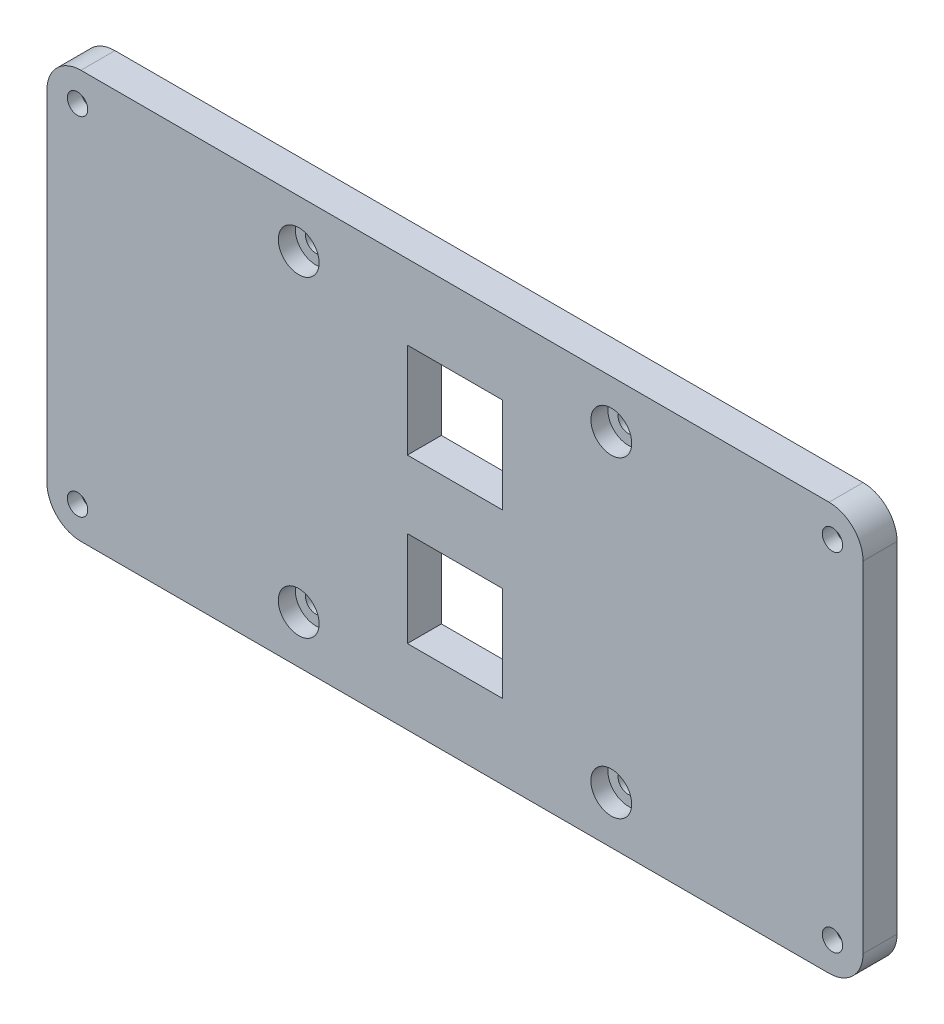
from build123d import *

# Parameters (mm, degrees)
SKETCH1_W           = 120
SKETCH1_H           = 60
BOSS_EXTRUDE1_DEPTH = 5
SKETCH1_6_R         = 1.5
CUT_EXTRUDE1_DEPTH  = 5
SKETCH1_7_R         = 3
CUT_EXTRUDE2_DEPTH  = 3
SKETCH1_12_R        = 3
CUT_EXTRUDE4_DEPTH  = 5
SKETCH1_13_R        = 3
SKETCH1_13_R_2      = 1.5
BOSS_EXTRUDE2_DEPTH = 2.5
FILLET1_R           = 5
SKETCH3_W           = 14
SKETCH3_H           = 14
CUT_EXTRUDE8_DEPTH  = 10


with BuildPart() as part:
    # Sketch1 → Boss-Extrude1 (new body)
    with BuildSketch(Plane.XY):
        with Locations((60, 30)):
            Rectangle(SKETCH1_W, SKETCH1_H)
    extrude(amount=BOSS_EXTRUDE1_DEPTH)

    # Sketch1<6> → Cut-Extrude1 (cut)
    with BuildSketch(Plane.XY):
        with Locations((4.5, 55.5)):
            Circle(SKETCH1_6_R)
        with Locations((115.5, 55.5)):
            Circle(SKETCH1_6_R)
        with Locations((4.5, 4.5)):
            Circle(SKETCH1_6_R)
        with Locations((115.5, 4.5)):
            Circle(SKETCH1_6_R)
    extrude(amount=CUT_EXTRUDE1_DEPTH, mode=Mode.SUBTRACT)

    # Sketch1<7> → Cut-Extrude2 (cut)
    with BuildSketch(Plane.XY):
        with Locations((4.5, 55.5)):
            Circle(SKETCH1_7_R)
        with Locations((115.5, 55.5)):
            Circle(SKETCH1_7_R)
        with Locations((4.5, 4.5)):
            Circle(SKETCH1_7_R)
        with Locations((115.5, 4.5)):
            Circle(SKETCH1_7_R)
    extrude(amount=CUT_EXTRUDE2_DEPTH, mode=Mode.SUBTRACT)

    # Sketch1<12> → Cut-Extrude4 (cut)
    with BuildSketch(Plane.XY):
        with Locations((37.019029611, 52.980970389)):
            Circle(SKETCH1_12_R)
        with Locations((82.980970389, 52.980970389)):
            Circle(SKETCH1_12_R)
        with Locations((37.019029611, 7.019029611)):
            Circle(SKETCH1_12_R)
        with Locations((82.980970389, 7.019029611)):
            Circle(SKETCH1_12_R)
    extrude(amount=CUT_EXTRUDE4_DEPTH, mode=Mode.SUBTRACT)

    # Sketch1<13> → Boss-Extrude2 (add)
    # profile 1 of 4: a face of its own
    with BuildSketch(Plane.XY):
        with Locations((82.980970389, 52.980970389)):
            Circle(SKETCH1_13_R)
        with Locations((82.980970389, 52.980970389)):
            Circle(SKETCH1_13_R_2, mode=Mode.SUBTRACT)
    # profile 2 of 4: a face of its own
    with BuildSketch(Plane.XY):
        with Locations((82.980970389, 7.019029611)):
            Circle(SKETCH1_13_R)
        with Locations((82.980970389, 7.019029611)):
            Circle(SKETCH1_13_R_2, mode=Mode.SUBTRACT)
    # profile 3 of 4: a face of its own
    with BuildSketch(Plane.XY):
        with Locations((37.019029611, 52.980970389)):
            Circle(SKETCH1_13_R)
        with Locations((37.019029611, 52.980970389)):
            Circle(SKETCH1_13_R_2, mode=Mode.SUBTRACT)
    # profile 4 of 4: a face of its own
    with BuildSketch(Plane.XY):
        with Locations((37.019029611, 7.019029611)):
            Circle(SKETCH1_13_R)
        with Locations((37.019029611, 7.019029611)):
            Circle(SKETCH1_13_R_2, mode=Mode.SUBTRACT)
    extrude(amount=BOSS_EXTRUDE2_DEPTH)

    # Fillet1
    fillet1_edges = [part.edges().sort_by_distance(p)[0] for p in [
        (0, 60, 2.5),
        (0, 0, 2.5),
        (120, 0, 2.5),
        (120, 60, 2.5),
    ]]
    fillet(fillet1_edges, radius=FILLET1_R)

    # Sketch3 → Cut-Extrude8 (cut)
    with BuildSketch(Plane.XY):
        with Locations((60, 18)):
            Rectangle(SKETCH3_W, SKETCH3_H)
        with Locations((60, 42)):
            Rectangle(SKETCH3_W, SKETCH3_H)
    extrude(amount=CUT_EXTRUDE8_DEPTH, mode=Mode.SUBTRACT)


solid = part.part
